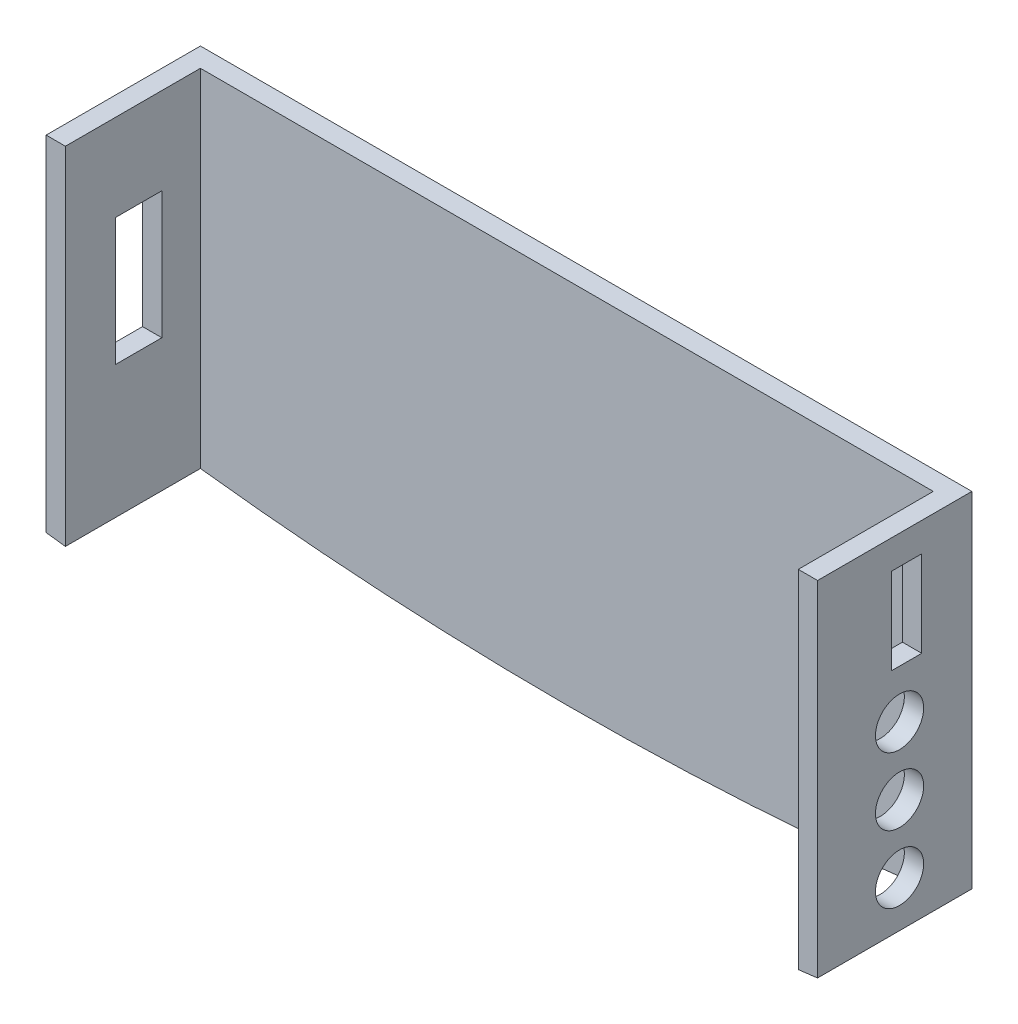
from build123d import *

# Parameters (mm, degrees)
SKETCH_1_W          = 80
SKETCH_1_H          = 35.7
EXTRUDE_1_DEPTH     = 16
SHELL_1_T           = -2
CUT_EXTRUDE_3_REACH = 89.586
SKETCH_2_W          = 4.8
SKETCH_2_H          = 13.2
CUT_EXTRUDE_4_REACH = 89.586
SKETCH_6_R          = 2.5
SKETCH_6_W          = 3.16
SKETCH_6_H          = 8.94


with BuildPart() as part:
    # 草图1 → 凸台-拉伸1 (new body)
    with BuildSketch(Plane.XY):
        with Locations((-50.420566467, -11.517328482)):
            Rectangle(SKETCH_1_W, SKETCH_1_H)
        with BuildLine():
            Line((-10.420566467, -29.367328482), (-90.420566467, -29.367328482))
            ThreePointArc((-90.420566467, -29.367328482), (-50.420566467, -31.863413079), (-10.420566467, -29.367328482))
        make_face()
    extrude(amount=EXTRUDE_1_DEPTH)

    # 抽壳1
    shell_1_openings = [part.faces().sort_by_distance(p)[0] for p in [
        (-50.420566467, -12.357406874, 16),
        (-50.420566467, 6.332671518, 8),
        (-50.420566467, -31.863413079, 8),
    ]]
    offset(amount=SHELL_1_T, openings=shell_1_openings, kind=Kind.INTERSECTION)

    # 草图2 → 切除-拉伸3 (cut, up to next)
    with BuildSketch(Plane.ZY.offset(90.420566467), mode=Mode.PRIVATE) as cut_extrude_3_sk1:
        with Locations((8.4, -9.267328482)):
            Rectangle(SKETCH_2_W, SKETCH_2_H)
    cut_extrude_3_tool1 = extrude(cut_extrude_3_sk1.sketch, amount=-CUT_EXTRUDE_3_REACH, mode=Mode.PRIVATE) & part.part
    add(cut_extrude_3_tool1.solids().sort_by_distance((-90.420566, -9.267328, 8.4))[0], mode=Mode.SUBTRACT)

    # 草图6 → 切除-拉伸4 (cut, up to next)
    with BuildSketch(Plane(origin=(-10.420566467, 0, 0), x_dir=(0, 0, -1), z_dir=(1, 0, 0)), mode=Mode.PRIVATE) as cut_extrude_4_sk1:
        with Locations((-7.5, -10.607328482)):
            Circle(SKETCH_6_R)
    cut_extrude_4_tool1 = extrude(cut_extrude_4_sk1.sketch, amount=-CUT_EXTRUDE_4_REACH, mode=Mode.PRIVATE) & part.part
    # 草图6 → 切除-拉伸4 (cut, up to next)
    with BuildSketch(Plane(origin=(-10.420566467, 0, 0), x_dir=(0, 0, -1), z_dir=(1, 0, 0)), mode=Mode.PRIVATE) as cut_extrude_4_sk2:
        with Locations((-7.5, -17.607328482)):
            Circle(SKETCH_6_R)
    cut_extrude_4_tool2 = extrude(cut_extrude_4_sk2.sketch, amount=-CUT_EXTRUDE_4_REACH, mode=Mode.PRIVATE) & part.part
    # 草图6 → 切除-拉伸4 (cut, up to next)
    with BuildSketch(Plane(origin=(-10.420566467, 0, 0), x_dir=(0, 0, -1), z_dir=(1, 0, 0)), mode=Mode.PRIVATE) as cut_extrude_4_sk3:
        with Locations((-7.5, -24.607328482)):
            Circle(SKETCH_6_R)
    cut_extrude_4_tool3 = extrude(cut_extrude_4_sk3.sketch, amount=-CUT_EXTRUDE_4_REACH, mode=Mode.PRIVATE) & part.part
    # 草图6 → 切除-拉伸4 (cut, up to next)
    with BuildSketch(Plane(origin=(-10.420566467, 0, 0), x_dir=(0, 0, -1), z_dir=(1, 0, 0)), mode=Mode.PRIVATE) as cut_extrude_4_sk4:
        with Locations((-6.78, -1.137328482)):
            Rectangle(SKETCH_6_W, SKETCH_6_H)
    cut_extrude_4_tool4 = extrude(cut_extrude_4_sk4.sketch, amount=-CUT_EXTRUDE_4_REACH, mode=Mode.PRIVATE) & part.part
    add(cut_extrude_4_tool1.solids().sort_by_distance((-10.420566, -10.607328, 7.5))[0], mode=Mode.SUBTRACT)
    add(cut_extrude_4_tool2.solids().sort_by_distance((-10.420566, -17.607328, 7.5))[0], mode=Mode.SUBTRACT)
    add(cut_extrude_4_tool3.solids().sort_by_distance((-10.420566, -24.607328, 7.5))[0], mode=Mode.SUBTRACT)
    add(cut_extrude_4_tool4.solids().sort_by_distance((-10.420566, -1.137328, 6.78))[0], mode=Mode.SUBTRACT)


solid = part.part
